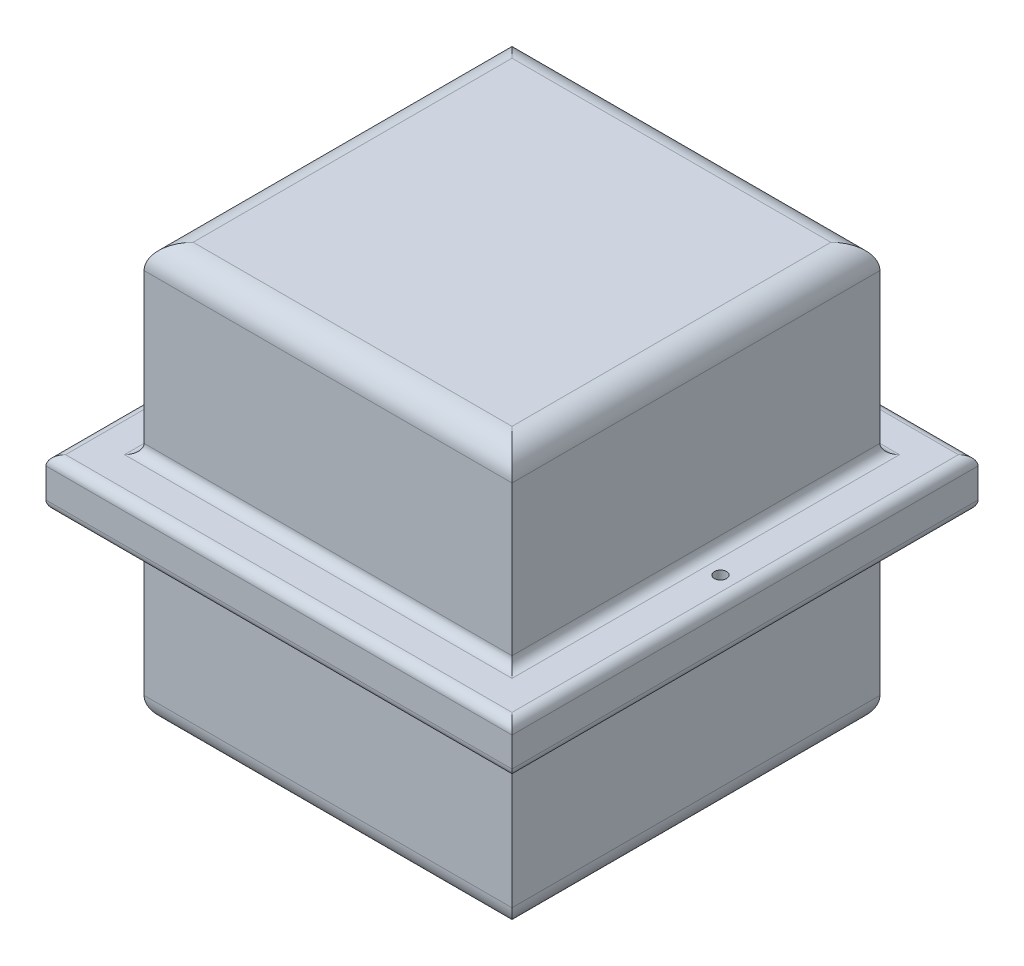
from build123d import *

# Parameters (mm, degrees)
SKETCH1_W           = 19.05
SKETCH1_H           = 19.05
BOSS_EXTRUDE1_DEPTH = 9.525
FILLET1_R           = 1.27
SKETCH2_W           = 24.13
SKETCH2_H           = 24.13
BOSS_EXTRUDE2_DEPTH = 1.27
FILLET2_R           = 0.508
SKETCH3_W           = 16.51
SKETCH3_H           = 16.51
CUT_EXTRUDE2_DEPTH  = 8.89
SKETCH4_R           = 0.3175
CUT_EXTRUDE3_DEPTH  = 33.830175525


with BuildPart() as part:
    # Sketch1 → Boss-Extrude1 (new body)
    with BuildSketch(Plane(origin=(0, 0, 0), x_dir=(1, 0, 0), z_dir=(0, 1, 0))):
        with Locations((9.525, 9.525)):
            Rectangle(SKETCH1_W, SKETCH1_H)
    extrude(amount=BOSS_EXTRUDE1_DEPTH)

    # Fillet1
    fillet1_edges = [part.edges().sort_by_distance(p)[0] for p in [
        (19.05, 9.525, -9.525),
        (9.525, 9.525, -19.05),
        (0, 9.525, -9.525),
        (9.525, 9.525, 0),
    ]]
    fillet(fillet1_edges, radius=FILLET1_R)

    # Sketch2 → Boss-Extrude2 (add)
    with BuildSketch(Plane.XZ):
        with Locations((9.525, -9.525)):
            Rectangle(SKETCH2_W, SKETCH2_H)
    extrude(amount=BOSS_EXTRUDE2_DEPTH)

    # Fillet2
    fillet2_edges = [part.edges().sort_by_distance(p)[0] for p in [
        (21.59, 0, -9.525),
        (9.525, 0, 2.54),
        (-2.54, 0, -9.525),
        (9.525, 0, -21.59),
        (9.525, 0, -19.05),
        (19.05, 0, -9.525),
        (9.525, 0, 0),
        (0, 0, -9.525),
    ]]
    fillet(fillet2_edges, radius=FILLET2_R)

    # Sketch3 → Cut-Extrude2 (cut)
    with BuildSketch(Plane.XZ.offset(1.27)):
        with Locations((9.525, -9.525)):
            Rectangle(SKETCH3_W, SKETCH3_H)
    extrude(amount=-CUT_EXTRUDE2_DEPTH, mode=Mode.SUBTRACT)

    # Mirror3: part across plane


with BuildPart() as part_1:
    add(part.part)
    add(part.part.mirror(Plane(origin=(0, -1.27, 0), x_dir=(0, 0, 1), z_dir=(0, -1, 0))))

    # Sketch4 → Cut-Extrude3 (cut, through all)
    with BuildSketch(Plane(origin=(0, 0, 0), x_dir=(1, 0, 0), z_dir=(0, 1, 0))):
        with Locations(Location((20.32, 9.525, 0), (0, 0, 270))):
            Circle(SKETCH4_R)
        with Locations(Location((-1.27, 9.525, 0), (0, 0, 270))):
            Circle(SKETCH4_R)
    extrude(amount=-CUT_EXTRUDE3_DEPTH, mode=Mode.SUBTRACT)


solid = part_1.part
